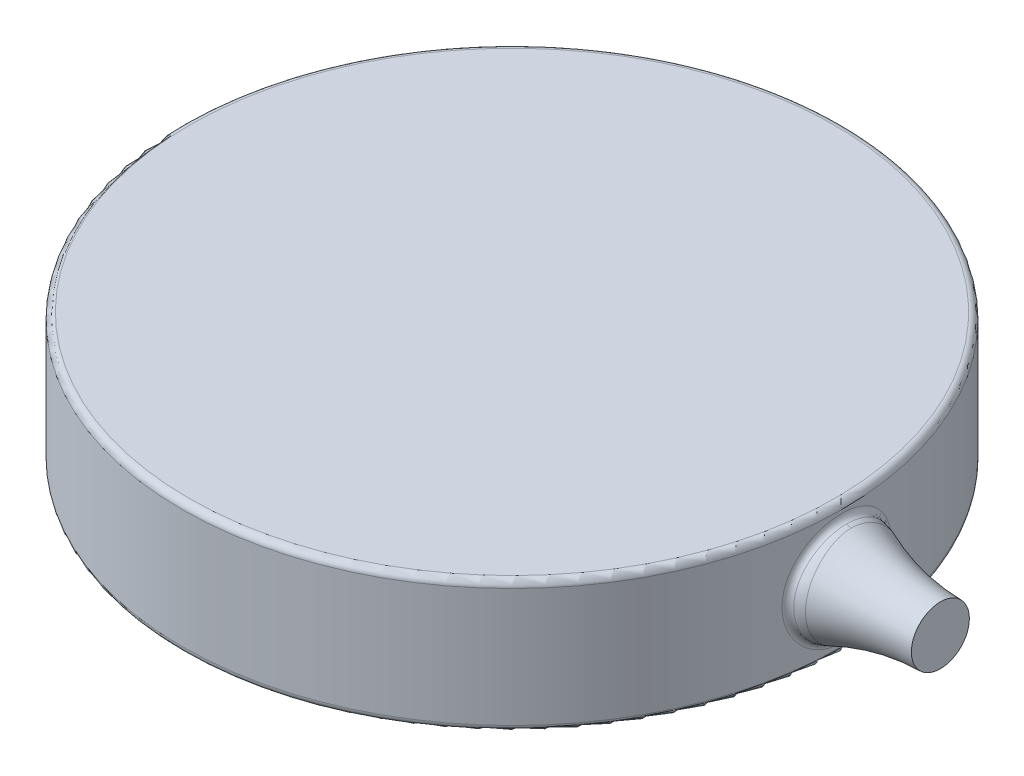
from build123d import *

# Parameters (mm, degrees)
SKETCH1_R           = 5
BOSS_EXTRUDE1_DEPTH = 2
SKETCH2_R           = 0.75
BOSS_EXTRUDE2_DEPTH = 6.5
FILLET2_R           = 0.1
FILLET3_R           = 0.4


with BuildPart() as part:
    # Sketch1 → Boss-Extrude1 (new body)
    with BuildSketch(Plane(origin=(0, 0, 0), x_dir=(1, 0, 0), z_dir=(0, 1, 0))):
        with Locations(Location((0, 0, 0), (0, 0, 270))):
            Circle(SKETCH1_R)
    extrude(amount=BOSS_EXTRUDE1_DEPTH)

    # Sketch2 → Boss-Extrude2 (add)
    with BuildSketch(Plane(origin=(0, 0, 0), x_dir=(0, 0, -1), z_dir=(1, 0, 0))):
        with Locations(Location((0, 1, 0), (0, 0, 180))):
            Circle(SKETCH2_R)
    extrude(amount=BOSS_EXTRUDE2_DEPTH)

    # Fillet2
    fillet2_edges = [part.edges().sort_by_distance(p)[0] for p in [
        (0, 0, -5),
        (0, 2, -5),
        (4.943429983, 1, -0.75),
    ]]
    fillet(fillet2_edges, radius=FILLET2_R)

    # Sketch3 → Cut-Revolve1 (revolve, cut)
    with BuildSketch(Plane.XY):
        with BuildLine():
            Line((5.099991295, 1.75), (6.5, 1.75))
            Line((6.5, 1.75), (6.5, 1.439938519))
            add(Edge.make_bspline(
                [(5.099991295, 1.75), (5.766866466, 1.452391497), (6.5, 1.439938519)],
                knots=[0, 0, 0, 1, 1, 1], degree=2))
        make_face()
    revolve(axis=Axis((6.5, 1, 0), (-1, 0, 0)), mode=Mode.SUBTRACT)

    # Fillet3
    fillet3_edges = [part.edges().sort_by_distance(p)[0] for p in [
        (5.099991295, 0.995851942, -0.749988529),
        (5.099991295, 1.004148058, 0.749988529),
    ]]
    fillet(fillet3_edges, radius=FILLET3_R)


solid = part.part
